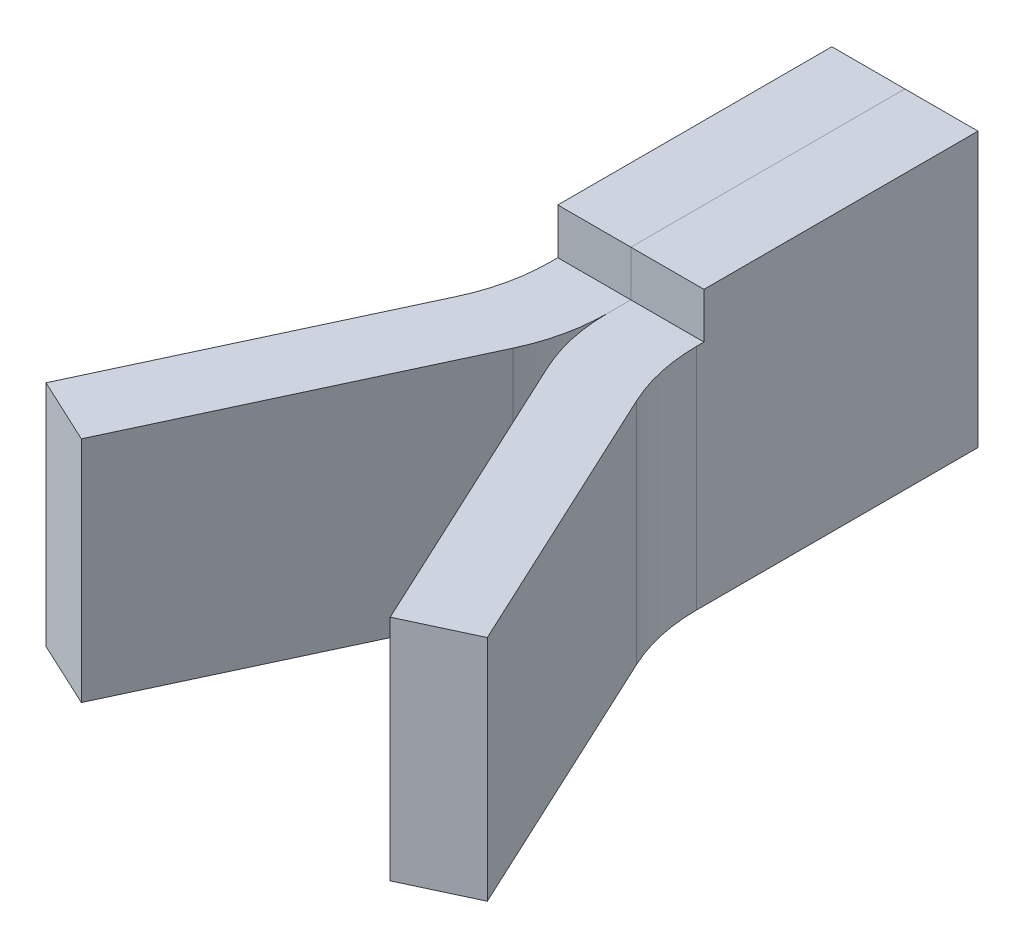
from build123d import *

# Parameters (mm, degrees)
BOSS_EXTRUDE1_DEPTH = 25
SKETCH2_W           = 8
SKETCH2_H           = 30
BOSS_EXTRUDE2_DEPTH = 5
FILLET1_R           = 20


with BuildPart() as part:
    # Sketch1 → Boss-Extrude1 (new body)
    with BuildSketch(Plane(origin=(0, 0, 0), x_dir=(1, 0, 0), z_dir=(0, 1, 0))):
        Polygon((0, 0), (0, 37), (8, 37), (8, 1.773557301), (24.155192766, -32.871365388), (16.90473047, -36.252311481), align=None)
    extrude(amount=BOSS_EXTRUDE1_DEPTH)

    # Sketch2 → Boss-Extrude2 (add)
    with BuildSketch(Plane(origin=(0, 25, 0), x_dir=(1, 0, 0), z_dir=(0, 1, 0))):
        with Locations((4, 22)):
            Rectangle(SKETCH2_W, SKETCH2_H)
    extrude(amount=BOSS_EXTRUDE2_DEPTH)

    # Fillet1
    fillet1_edges = [part.edges().sort_by_distance(p)[0] for p in [
        (0, 12.5, 0),
        (8, 12.5, -1.773557301),
    ]]
    fillet(fillet1_edges, radius=FILLET1_R)


with BuildPart() as body_2:
    # Mirror1: mirrored copy
    add(part.part.mirror(Plane(origin=(0, 0, 0), x_dir=(0, 0, 1), z_dir=(1, 0, 0))))


solid = Compound([part.part, body_2.part])
